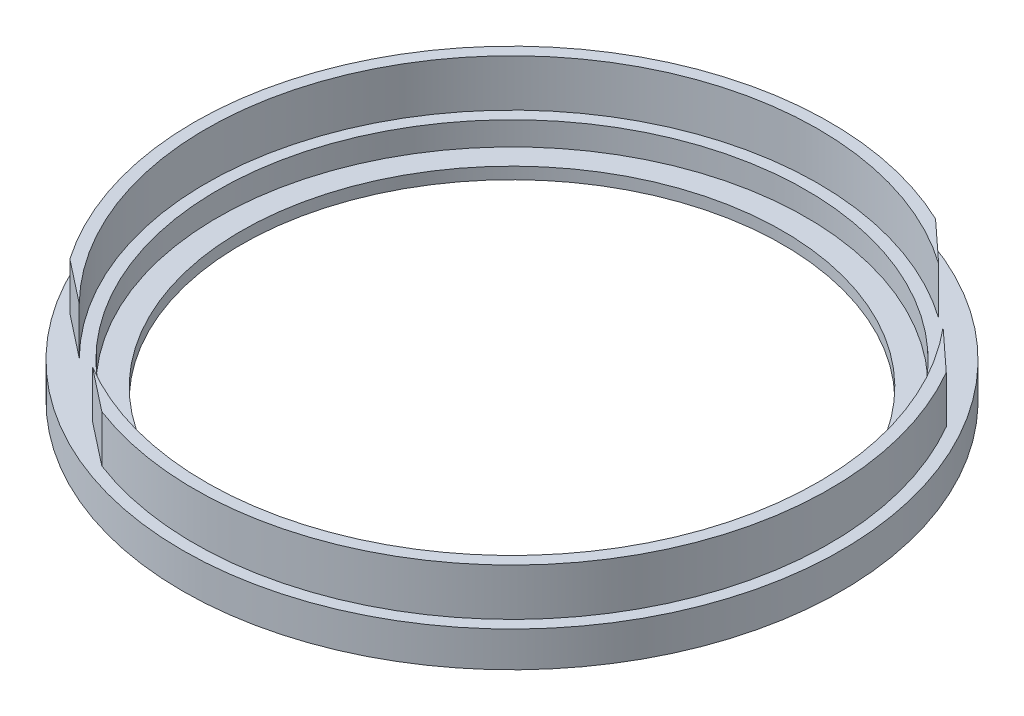
from build123d import *

# Parameters (mm, degrees)
ESQUISSE6_R             = 28
BOSS_EXTRU_3_DEPTH      = 3
ESQUISSE7_R             = 27
ESQUISSE7_R_2           = 26
BOSS_EXTRU_4_DEPTH      = 4
ESQUISSE8_R             = 25
ENL_V_MAT_EXTRU_2_DEPTH = 2
ESQUISSE9_R             = 23
ENL_V_MAT_EXTRU_3_DEPTH = 102.549659352
ENL_V_MAT_EXTRU_4_DEPTH = 4


with BuildPart() as part:
    # Esquisse6 → Boss.-Extru.3 (new body)
    with BuildSketch(Plane(origin=(0, 0, 0), x_dir=(1, 0, 0), z_dir=(0, 1, 0))):
        with Locations(Location((-49.260149918, 37.629281188, 0), (0, 0, 270))):
            Circle(ESQUISSE6_R)
    extrude(amount=BOSS_EXTRU_3_DEPTH)

    # Esquisse7 → Boss.-Extru.4 (add)
    with BuildSketch(Plane(origin=(0, 3, 0), x_dir=(1, 0, 0), z_dir=(0, 1, 0))):
        with Locations(Location((-49.260149918, 37.629281188, 0), (0, 0, 270))):
            Circle(ESQUISSE7_R)
        with Locations(Location((-49.260149918, 37.629281188, 0), (0, 0, 270))):
            Circle(ESQUISSE7_R_2, mode=Mode.SUBTRACT)
    extrude(amount=BOSS_EXTRU_4_DEPTH)

    # Esquisse8 → Enlèv. mat.-Extru.2 (cut)
    with BuildSketch(Plane(origin=(0, 3, 0), x_dir=(1, 0, 0), z_dir=(0, 1, 0))):
        with Locations(Location((-49.260149918, 37.629281188, 0), (0, 0, 270))):
            Circle(ESQUISSE8_R)
    extrude(amount=-ENL_V_MAT_EXTRU_2_DEPTH, mode=Mode.SUBTRACT)

    # Esquisse9 → Enlèv. mat.-Extru.3 (cut, through all)
    with BuildSketch(Plane(origin=(0, 1, 0), x_dir=(1, 0, 0), z_dir=(0, 1, 0))):
        with Locations(Location((-49.260149918, 37.629281188, 0), (0, 0, 270))):
            Circle(ESQUISSE9_R)
    extrude(amount=-ENL_V_MAT_EXTRU_3_DEPTH, mode=Mode.SUBTRACT)

    # Esquisse10 → Enlèv. mat.-Extru.4 (cut)
    with BuildSketch(Plane(origin=(0, 7, 0), x_dir=(1, 0, 0), z_dir=(0, 1, 0))):
        Polygon((-71.468932312, 22.27447788), (-58.878892443, 12.400730055), (-61.579583758, 8.957071992), (-74.169623626, 18.830819817), align=None)
        Polygon((-22.927613797, 54.376268132), (-25.894954155, 51.159529779), (-37.65537385, 62.00814852), (-34.688033492, 65.224886873), align=None)
    extrude(amount=-ENL_V_MAT_EXTRU_4_DEPTH, mode=Mode.SUBTRACT)


solid = part.part
